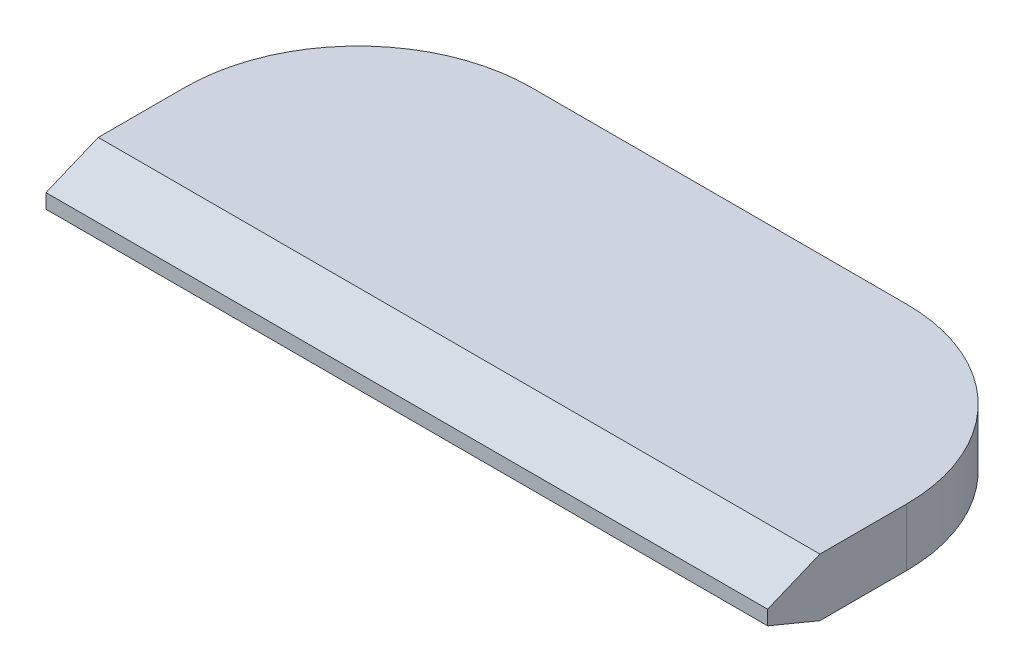
from build123d import *

# Parameters (mm, degrees)
PROFILE_SKETCH_W         = 25
PROFILE_SKETCH_H         = 10.810660172
THICKNESS_EXTRUDE_DEPTH  = 2
FILLETS_R                = 6
CONNECTION_CHAMFER_SIZE  = 0.75
CONNECTION_CHAMFER_SIZE2 = 1.810660172


with BuildPart() as part:
    # Profile Sketch → Thickness Extrude (new body)
    with BuildSketch(Plane(origin=(0, 0, 0), x_dir=(1, 0, 0), z_dir=(0, 1, 0))):
        with Locations((12.5, 5.405330086)):
            Rectangle(PROFILE_SKETCH_W, PROFILE_SKETCH_H)
    extrude(amount=THICKNESS_EXTRUDE_DEPTH)

    # Fillets
    fillets_edges = [part.edges().sort_by_distance(p)[0] for p in [
        (0, 1, -10.810660172),
        (25, 1, -10.810660172),
    ]]
    fillet(fillets_edges, radius=FILLETS_R)

    # Connection Chamfer
    connection_chamfer_edges = [part.edges().sort_by_distance(p)[0] for p in [
        (12.5, 0, 0),
        (12.5, 2, 0),
    ]]
    connection_chamfer_side = [part.faces().sort_by_distance(p)[0] for p in [
        (12.5, 1, 0),
    ]]
    chamfer(connection_chamfer_edges, length=CONNECTION_CHAMFER_SIZE, length2=CONNECTION_CHAMFER_SIZE2, reference=connection_chamfer_side[0])


solid = part.part
